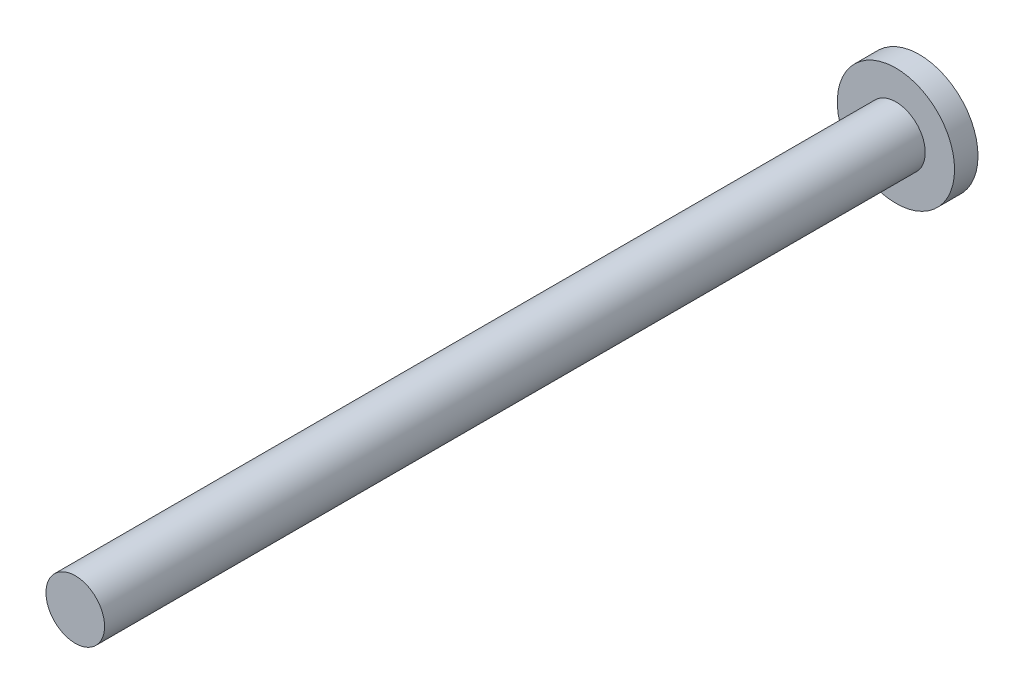
from build123d import *


with BuildPart() as part:
    # Sketch1 → Revolve1 (revolve)
    with BuildSketch(Plane(origin=(0, 0, 0), x_dir=(1, 0, 0), z_dir=(0, 1, 0))):
        Polygon((0, 0), (0, 72), (5, 72), (5, 70), (2.5, 70), (2.5, 0), align=None)
    revolve(axis=Axis((0, 0, 0), (0, 0, -1)))


solid = part.part
